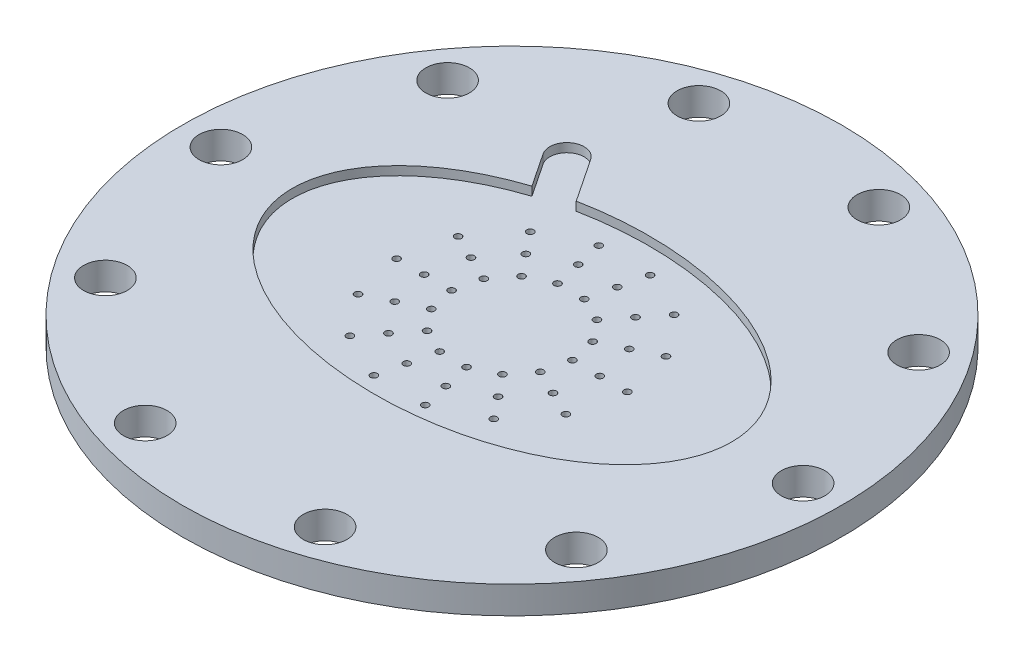
from build123d import *

# Parameters (mm, degrees)
F_3_8_CLEARANCE_HOLE1_D = 10.0838
CIRPATTERN1_COUNT       = 10
SKETCH5_RX              = 50.8
SKETCH5_RY              = 31.75
CUT_EXTRUDE1_DEPTH      = 2.032
SKETCH6_R               = 0.79375
CUT_EXTRUDE2_DEPTH      = 108.849548557


with BuildPart() as part:
    # Sketch1 → Revolve1 (revolve)
    with BuildSketch(Plane.XY):
        Polygon((0, -6.35), (54.8259, -6.35), (54.8259, -3.6576), (58.8899, -3.6576), (58.8899, -6.35), (76.2, -6.35), (76.2, 0), (0, 0), align=None)
    revolve(axis=Axis((0, 0, 0), (0, -1, 0)))

    # 3/8 Clearance Hole1 (through all)
    with Locations(Plane(origin=(67.31, 0, 0), x_dir=(0, 0, 1), z_dir=(0, 1, 0))):
        with Locations((0, 0)):
            f_3_8_clearance_hole1 = Hole(F_3_8_CLEARANCE_HOLE1_D / 2)

    # CirPattern1: 3/8 Clearance Hole1 ×10 about axis
    cirpattern1_axis = Axis((0, 0.3175, 0), (0, -1, 0))
    for i in range(1, CIRPATTERN1_COUNT):
        add(f_3_8_clearance_hole1.rotate(cirpattern1_axis, i * 360 / CIRPATTERN1_COUNT), mode=Mode.SUBTRACT)

    # Sketch5 → Cut-Extrude1 (cut)
    with BuildSketch(Plane(origin=(0, 0, 0), x_dir=(1, 0, 0), z_dir=(0, 1, 0))):
        with Locations((0, 0)):
            Ellipse(SKETCH5_RX, SKETCH5_RY)
        with BuildLine():
            Line((-3.302199606, -2.201466404), (-28.702199606, 35.898533596))
            ThreePointArc((-28.702199606, 35.898533596), (-27.601466404, 41.402199606), (-22.097800394, 40.301466404))
            Line((-22.097800394, 40.301466404), (3.302199606, 2.201466404))
            ThreePointArc((3.302199606, 2.201466404), (2.201466404, -3.302199606), (-3.302199606, -2.201466404))
        make_face()
    extrude(amount=-CUT_EXTRUDE1_DEPTH, mode=Mode.SUBTRACT)

    # Sketch6 → Cut-Extrude2 (cut, through all)
    with BuildSketch(Plane(origin=(0, -2.032, 0), x_dir=(1, 0, 0), z_dir=(0, 1, 0))):
        with Locations((13.97, 0)):
            Circle(SKETCH6_R)
        with Locations((20.32, 0)):
            Circle(SKETCH6_R)
        with Locations((26.67, 0)):
            Circle(SKETCH6_R)
        with Locations((12.586535085, -6.061355835)):
            Circle(SKETCH6_R)
        with Locations((18.307687396, -8.816517579)):
            Circle(SKETCH6_R)
        with Locations((24.028839707, -11.571679322)):
            Circle(SKETCH6_R)
        with Locations((8.710152532, -10.92218581)):
            Circle(SKETCH6_R)
        with Locations((12.669312774, -15.886815724)):
            Circle(SKETCH6_R)
        with Locations((16.628473016, -20.851445637)):
            Circle(SKETCH6_R)
        with Locations((3.108617447, -13.619742933)):
            Circle(SKETCH6_R)
        with Locations((4.521625378, -19.810535176)):
            Circle(SKETCH6_R)
        with Locations((5.934633309, -26.001327418)):
            Circle(SKETCH6_R)
        with Locations((-3.108617447, -13.619742933)):
            Circle(SKETCH6_R)
        with Locations((-4.521625378, -19.810535176)):
            Circle(SKETCH6_R)
        with Locations((-5.934633309, -26.001327418)):
            Circle(SKETCH6_R)
        with Locations((-8.710152532, -10.92218581)):
            Circle(SKETCH6_R)
        with Locations((-12.669312774, -15.886815724)):
            Circle(SKETCH6_R)
        with Locations((-16.628473016, -20.851445637)):
            Circle(SKETCH6_R)
        with Locations((-12.586535085, -6.061355835)):
            Circle(SKETCH6_R)
        with Locations((-18.307687396, -8.816517579)):
            Circle(SKETCH6_R)
        with Locations((-24.028839707, -11.571679322)):
            Circle(SKETCH6_R)
        with Locations((-13.97, 0)):
            Circle(SKETCH6_R)
        with Locations((-20.32, 0)):
            Circle(SKETCH6_R)
        with Locations((-26.67, 0)):
            Circle(SKETCH6_R)
        with Locations((-12.586535085, 6.061355835)):
            Circle(SKETCH6_R)
        with Locations((-18.307687396, 8.816517579)):
            Circle(SKETCH6_R)
        with Locations((-24.028839707, 11.571679322)):
            Circle(SKETCH6_R)
        with Locations((-8.710152532, 10.92218581)):
            Circle(SKETCH6_R)
        with Locations((-12.669312774, 15.886815724)):
            Circle(SKETCH6_R)
        with Locations((-16.628473016, 20.851445637)):
            Circle(SKETCH6_R)
        with Locations((-3.108617447, 13.619742933)):
            Circle(SKETCH6_R)
        with Locations((-4.521625378, 19.810535176)):
            Circle(SKETCH6_R)
        with Locations((-5.934633309, 26.001327418)):
            Circle(SKETCH6_R)
        with Locations((3.108617447, 13.619742933)):
            Circle(SKETCH6_R)
        with Locations((4.521625378, 19.810535176)):
            Circle(SKETCH6_R)
        with Locations((5.934633309, 26.001327418)):
            Circle(SKETCH6_R)
        with Locations((8.710152532, 10.92218581)):
            Circle(SKETCH6_R)
        with Locations((12.669312774, 15.886815724)):
            Circle(SKETCH6_R)
        with Locations((16.628473016, 20.851445637)):
            Circle(SKETCH6_R)
        with Locations((12.586535085, 6.061355835)):
            Circle(SKETCH6_R)
        with Locations((18.307687396, 8.816517579)):
            Circle(SKETCH6_R)
        with Locations((24.028839707, 11.571679322)):
            Circle(SKETCH6_R)
    extrude(amount=-CUT_EXTRUDE2_DEPTH, mode=Mode.SUBTRACT)


solid = part.part
